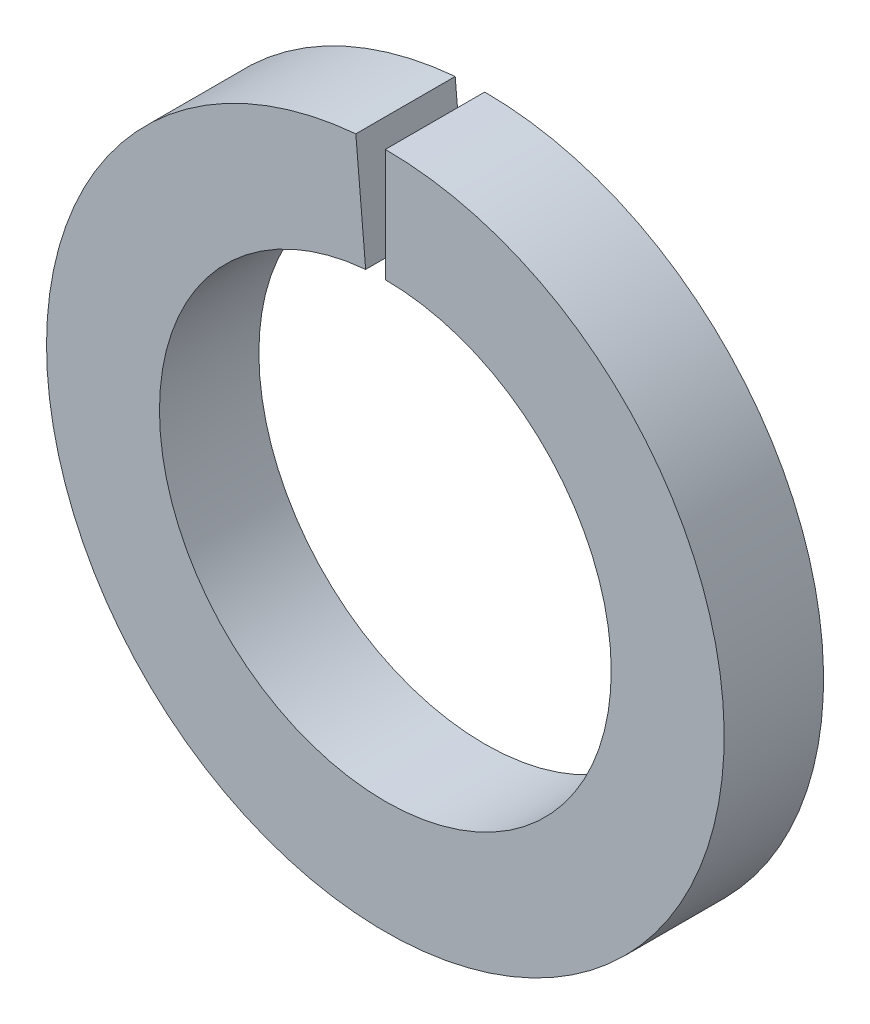
from build123d import *

# Parameters (mm, degrees)
EXTRUDE_1_DEPTH = 2.2


with BuildPart() as part:
    # 草图1 → 凸台-拉伸1 (new body)
    with BuildSketch(Plane.XY):
        with BuildLine():
            Line((0, 5), (0, 7.5))
            ThreePointArc((0, 7.5), (0.327145405, -7.492861662), (-0.653668071, 7.471460236))
            Line((-0.653668071, 7.471460236), (-0.435778714, 4.98097349))
            ThreePointArc((-0.435778714, 4.98097349), (0.218096937, -4.995241108), (0, 5))
        make_face()
    extrude(amount=EXTRUDE_1_DEPTH)


solid = part.part
